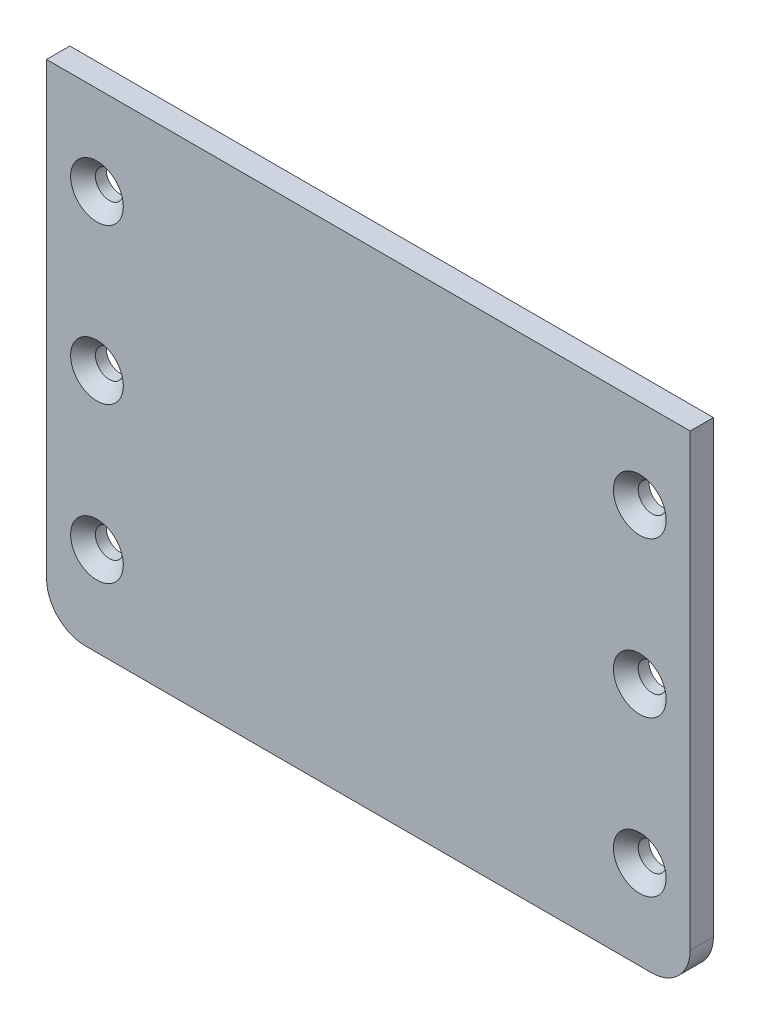
from build123d import *

# Parameters (mm, degrees)
SKETCH1_W                                       = 11
SKETCH1_H                                       = 63
SKETCH1_W_2                                     = 60
SKETCH1_H_2                                     = 60
BOSS_EXTRUDE1_DEPTH                             = 3
CSK_FOR_M3_FLAT_HEAD_MACHINE_SCREW1_D           = 3.6
CSK_FOR_M3_FLAT_HEAD_MACHINE_SCREW1_DEPTH       = 6
CSK_FOR_M3_FLAT_HEAD_MACHINE_SCREW1_CSINK_D     = 6.8
CSK_FOR_M3_FLAT_HEAD_MACHINE_SCREW1_CSINK_ANGLE = 90
CSK_FOR_M3_FLAT_HEAD_MACHINE_SCREW1_TIP         = 1.081549114
FILLET1_R                                       = 5


with BuildPart() as part:
    # Sketch1 → Boss-Extrude1 (new body)
    with BuildSketch(Plane.XY):
        with Locations((-66.5, 31.5)):
            Rectangle(SKETCH1_W, SKETCH1_H)
        Polygon((-60, 60), (0, 60), (0, 63), (-61, 63), (-61, 0), (-60, 0), align=None)
        with Locations((-30, 30)):
            Rectangle(SKETCH1_W_2, SKETCH1_H_2)
        with Locations((5.5, 31.5)):
            Rectangle(SKETCH1_W, SKETCH1_H)
    extrude(amount=BOSS_EXTRUDE1_DEPTH)

    # CSK for M3 Flat Head Machine Screw1
    with Locations(Plane.XY.offset(3)):
        with Locations((-65.5, 31.5), (-65.5, 51.5), (-65.5, 11.5), (4.5, 11.5), (4.5, 31.5), (4.5, 51.5)):
            CounterSinkHole(CSK_FOR_M3_FLAT_HEAD_MACHINE_SCREW1_D / 2, CSK_FOR_M3_FLAT_HEAD_MACHINE_SCREW1_CSINK_D / 2, depth=CSK_FOR_M3_FLAT_HEAD_MACHINE_SCREW1_DEPTH, counter_sink_angle=CSK_FOR_M3_FLAT_HEAD_MACHINE_SCREW1_CSINK_ANGLE)
            with Locations((0, 0, -(CSK_FOR_M3_FLAT_HEAD_MACHINE_SCREW1_DEPTH + CSK_FOR_M3_FLAT_HEAD_MACHINE_SCREW1_TIP / 2))):  # 118° drill point
                Cone(0, CSK_FOR_M3_FLAT_HEAD_MACHINE_SCREW1_D / 2, CSK_FOR_M3_FLAT_HEAD_MACHINE_SCREW1_TIP, mode=Mode.SUBTRACT)

    # Fillet1
    fillet1_edges = [part.edges().sort_by_distance(p)[0] for p in [
        (11, 0, 1.5),
        (-72, 0, 1.5),
    ]]
    fillet(fillet1_edges, radius=FILLET1_R)


solid = part.part
